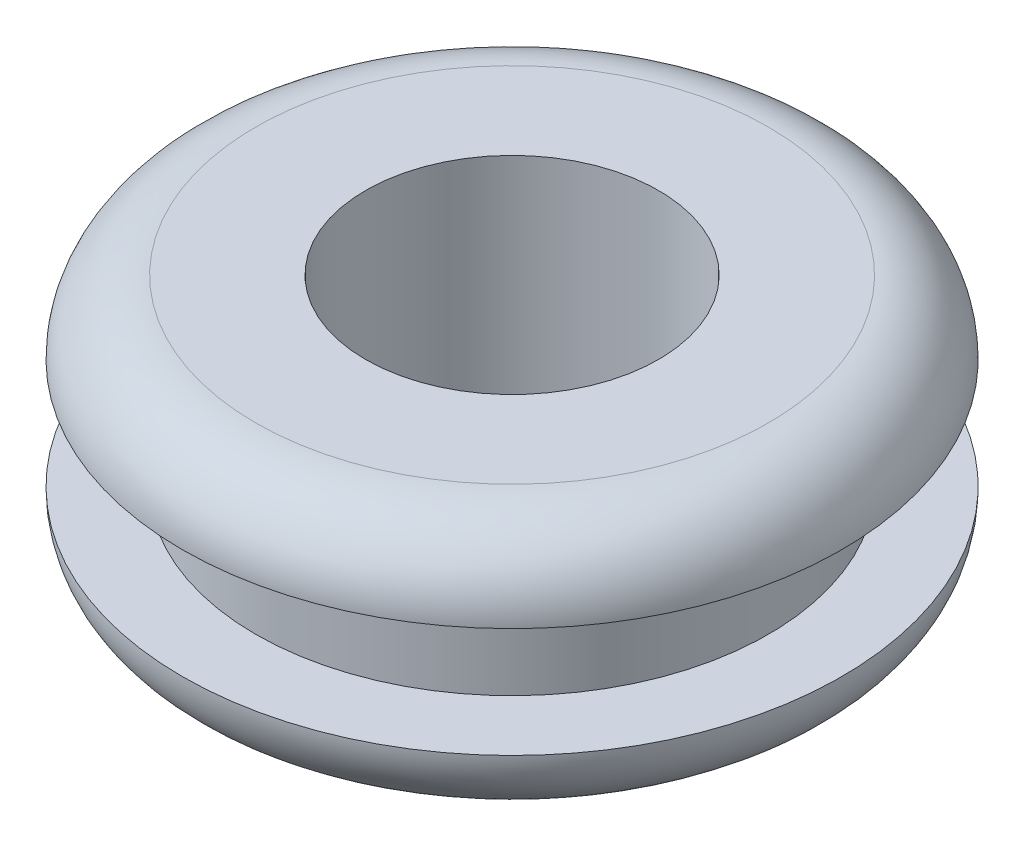
from build123d import *


with BuildPart() as part:
    # Sketch2 → Revolve1 (revolve)
    with BuildSketch(Plane.XY, mode=Mode.PRIVATE) as revolve1_sk:
        with BuildLine():
            Line((5.55625, 1.190625), (7.14375, 1.190625))
            ThreePointArc((7.14375, 1.190625), (6.678782015, 2.313157015), (5.55625, 2.778125))
            Line((5.55625, 2.778125), (3.175, 2.778125))
            Line((3.175, 2.778125), (3.175, -2.778125))
            Line((3.175, -2.778125), (5.55625, -2.778125))
            ThreePointArc((5.55625, -2.778125), (6.678782015, -2.313157015), (7.14375, -1.190625))
            Line((7.14375, -1.190625), (5.55625, -1.190625))
            Line((5.55625, -1.190625), (5.55625, 1.190625))
        make_face()
    revolve(revolve1_sk.sketch.rotate(Axis((0, 2.778125, 0), (0, -1, 0)), 90), axis=Axis((0, 2.778125, 0), (0, -1, 0)))


solid = part.part
